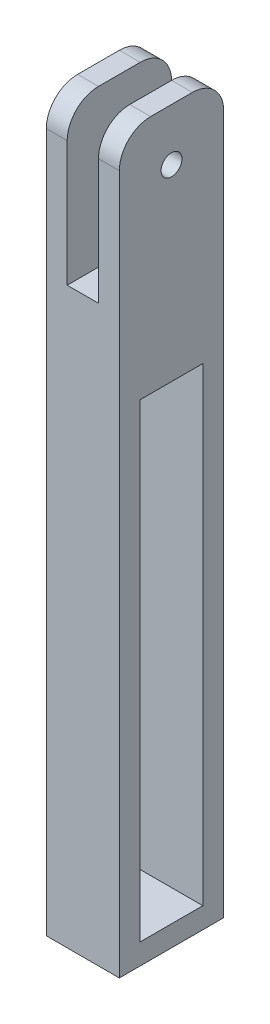
from build123d import *

# Parameters (mm, degrees)
SKETCH1_W           = 35
SKETCH1_H           = 50
BOSS_EXTRUDE1_DEPTH = 350
CUT_EXTRUDE1_DEPTH  = 350
SKETCH3_W           = 30
SKETCH3_H           = 225
CUT_EXTRUDE2_DEPTH  = 350
SKETCH4_W           = 15
SKETCH4_H           = 75
CUT_EXTRUDE3_DEPTH  = 350
SKETCH5_R           = 5
CUT_EXTRUDE4_DEPTH  = 356.28157847


with BuildPart() as part:
    # Sketch1 → Boss-Extrude1 (new body)
    with BuildSketch(Plane(origin=(0, 0, 0), x_dir=(1, 0, 0), z_dir=(0, 1, 0))):
        with Locations((17.5, 25)):
            Rectangle(SKETCH1_W, SKETCH1_H)
    extrude(amount=BOSS_EXTRUDE1_DEPTH)

    # Sketch2 → Cut-Extrude1 (cut)
    with BuildSketch(Plane(origin=(35, 0, 0), x_dir=(0, 0, -1), z_dir=(1, 0, 0))):
        with BuildLine():
            ThreePointArc((0, 335), (4.393398282, 345.606601718), (15, 350))
            Line((15, 350), (0, 350))
            Line((0, 350), (0, 335))
        make_face()
        with BuildLine():
            Line((50, 350), (35, 350))
            ThreePointArc((35, 350), (45.606601718, 345.606601718), (50, 335))
            Line((50, 335), (50, 350))
        make_face()
    extrude(amount=-CUT_EXTRUDE1_DEPTH, mode=Mode.SUBTRACT)

    # Sketch3 → Cut-Extrude2 (cut)
    with BuildSketch(Plane(origin=(35, 0, 0), x_dir=(0, 0, -1), z_dir=(1, 0, 0))):
        with Locations((25, 122.5)):
            Rectangle(SKETCH3_W, SKETCH3_H)
    extrude(amount=-CUT_EXTRUDE2_DEPTH, mode=Mode.SUBTRACT)

    # Sketch4 → Cut-Extrude3 (cut)
    with BuildSketch(Plane.XY):
        with Locations((17.5, 312.5)):
            Rectangle(SKETCH4_W, SKETCH4_H)
    extrude(amount=-CUT_EXTRUDE3_DEPTH, mode=Mode.SUBTRACT)

    # Sketch5 → Cut-Extrude4 (cut, through all)
    with BuildSketch(Plane.ZY):
        with Locations((-25, 325)):
            Circle(SKETCH5_R)
    extrude(amount=-CUT_EXTRUDE4_DEPTH, mode=Mode.SUBTRACT)


solid = part.part
